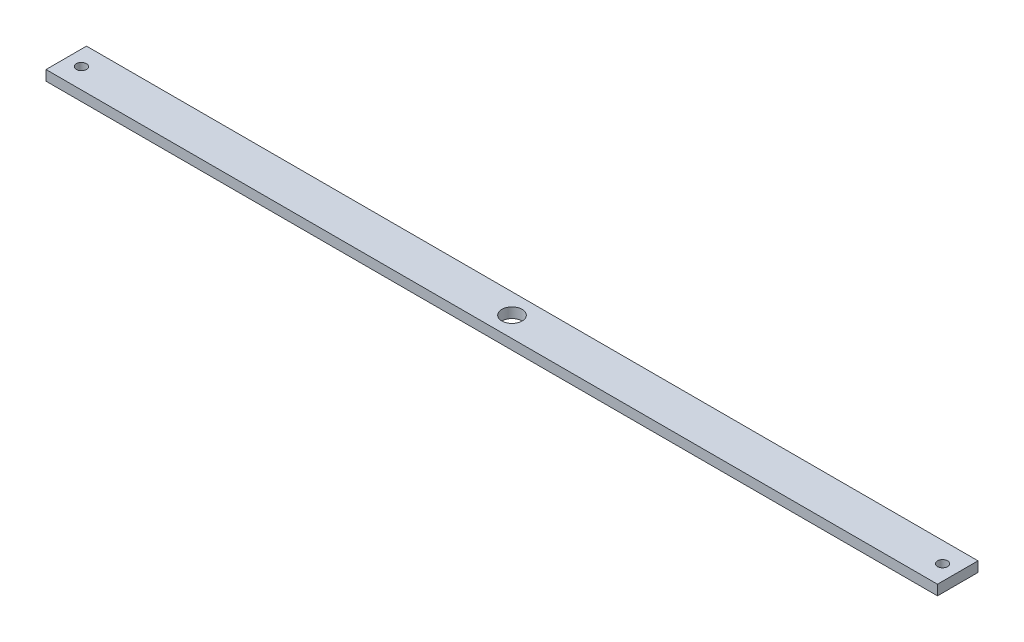
from build123d import *

# Parameters (mm, degrees)
SKETCH1_W                       = 558.8
SKETCH1_H                       = 25.4
BOSS_EXTRUDE1_DEPTH             = 6.35
F_1_4_0_25_DIAMETER_HOLE1_D     = 6.35
F_1_4_0_25_DIAMETER_HOLE1_DEPTH = 17.019524
F_1_4_0_25_DIAMETER_HOLE1_TIP   = 1.907732465
SKETCH5_R                       = 6.35
CUT_EXTRUDE1_DEPTH              = 280.760562803


with BuildPart() as part:
    # Sketch1 → Boss-Extrude1 (new body)
    with BuildSketch(Plane(origin=(0, 0, 0), x_dir=(1, 0, 0), z_dir=(0, 1, 0))):
        Rectangle(SKETCH1_W, SKETCH1_H)
    extrude(amount=BOSS_EXTRUDE1_DEPTH)

    # 1/4 (0.25) Diameter Hole1
    with Locations(Plane(origin=(0, 6.35, 0), x_dir=(1, 0, 0), z_dir=(0, 1, 0))):
        with Locations((-269.875, 0), (269.875, 0)):
            Hole(F_1_4_0_25_DIAMETER_HOLE1_D / 2, depth=F_1_4_0_25_DIAMETER_HOLE1_DEPTH)
            with Locations((0, 0, -(F_1_4_0_25_DIAMETER_HOLE1_DEPTH + F_1_4_0_25_DIAMETER_HOLE1_TIP / 2))):  # 118° drill point
                Cone(0, F_1_4_0_25_DIAMETER_HOLE1_D / 2, F_1_4_0_25_DIAMETER_HOLE1_TIP, mode=Mode.SUBTRACT)

    # Sketch5 → Cut-Extrude1 (cut, through all)
    with BuildSketch(Plane(origin=(0, 6.35, 0), x_dir=(1, 0, 0), z_dir=(0, 1, 0))):
        with Locations(Location((0, 0, 0), (0, 0, 270))):
            Circle(SKETCH5_R)
    extrude(amount=-CUT_EXTRUDE1_DEPTH, mode=Mode.SUBTRACT)


solid = part.part
